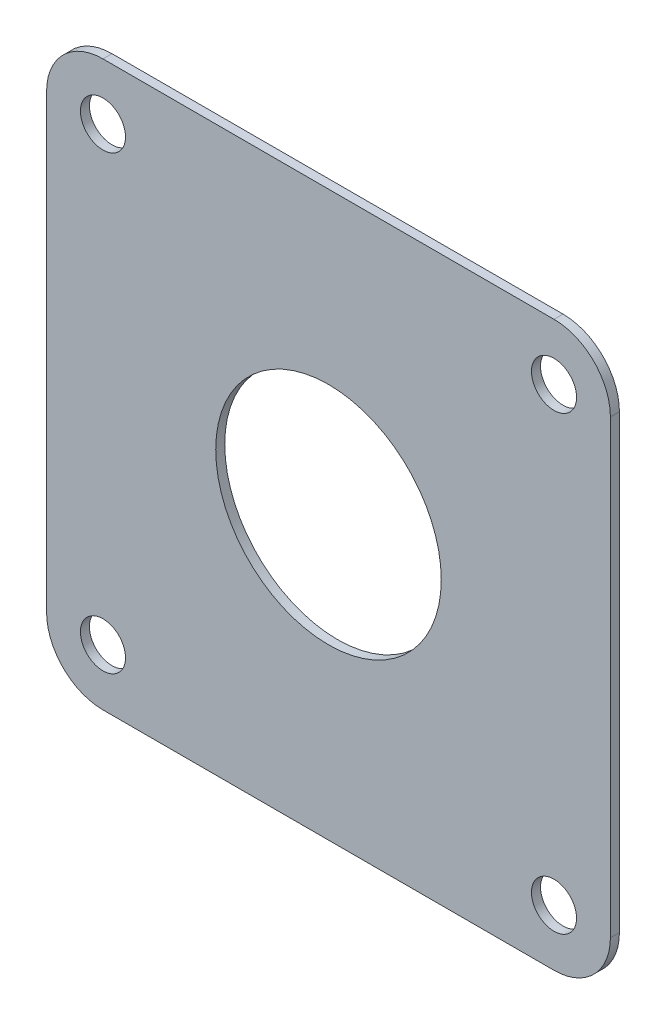
from build123d import *

# Parameters (mm, degrees)
SKETCH1_W           = 50
SKETCH1_H           = 50
BOSS_EXTRUDE1_DEPTH = 0.8
FILLET1_R           = 5
SKETCH2_R           = 2
CUT_EXTRUDE1_DEPTH  = 36.364388868
SKETCH3_R           = 19.807187389
BOSS_EXTRUDE2_DEPTH = 1.5
SKETCH4_R           = 17.5
CUT_EXTRUDE2_DEPTH  = 1.5
SKETCH6_R           = 10
CUT_EXTRUDE3_DEPTH  = 36.387144558


with BuildPart() as part:
    # Sketch1 → Boss-Extrude1 (new body)
    with BuildSketch(Plane.XY):
        Rectangle(SKETCH1_W, SKETCH1_H)
    extrude(amount=BOSS_EXTRUDE1_DEPTH)

    # Fillet1
    fillet1_edges = [part.edges().sort_by_distance(p)[0] for p in [
        (25, -25, 0.4),
        (-25, -25, 0.4),
        (-25, 25, 0.4),
        (25, 25, 0.4),
    ]]
    fillet(fillet1_edges, radius=FILLET1_R)

    # Sketch2 → Cut-Extrude1 (cut, through all)
    with BuildSketch(Plane(origin=(0, 0, 0), x_dir=(-1, 0, 0), z_dir=(0, 0, -1))):
        with Locations((-20, 20)):
            Circle(SKETCH2_R)
        with Locations((20, 20)):
            Circle(SKETCH2_R)
        with Locations((20, -20)):
            Circle(SKETCH2_R)
        with Locations((-20, -20)):
            Circle(SKETCH2_R)
    extrude(amount=-CUT_EXTRUDE1_DEPTH, mode=Mode.SUBTRACT)

    # Sketch3 → Boss-Extrude2 (add)
    with BuildSketch(Plane(origin=(0, 0, 0), x_dir=(-1, 0, 0), z_dir=(0, 0, -1))):
        with Locations(Location((0, 0, 0), (0, 0, 180))):
            Circle(SKETCH3_R)
    extrude(amount=BOSS_EXTRUDE2_DEPTH)

    # Sketch4 → Cut-Extrude2 (cut)
    with BuildSketch(Plane(origin=(0, 0, -1.5), x_dir=(-1, 0, 0), z_dir=(0, 0, -1))):
        Circle(SKETCH4_R)
    extrude(amount=-CUT_EXTRUDE2_DEPTH, mode=Mode.SUBTRACT)

    # Sketch6 → Cut-Extrude3 (cut, through all)
    with BuildSketch(Plane(origin=(0, 0, 0), x_dir=(-1, 0, 0), z_dir=(0, 0, -1))):
        Circle(SKETCH6_R)
    extrude(amount=-CUT_EXTRUDE3_DEPTH, mode=Mode.SUBTRACT)


solid = part.part
